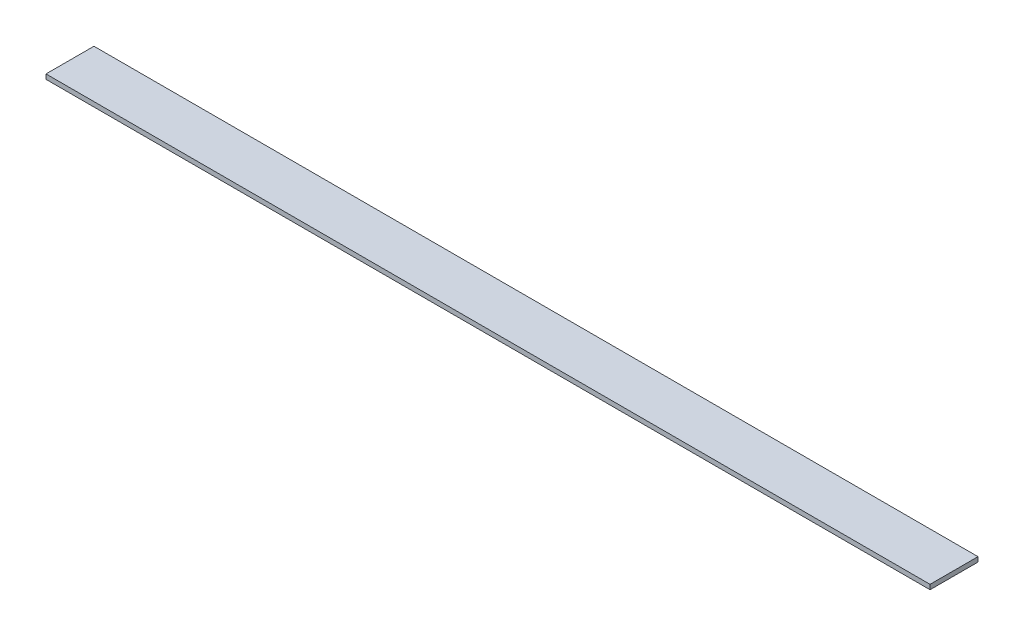
from build123d import *

# Parameters (mm, degrees)
SKETCH1_W           = 1873.25
SKETCH1_H           = 101.6
BOSS_EXTRUDE1_DEPTH = 10


with BuildPart() as part:
    # Sketch1 → Boss-Extrude1 (new body)
    with BuildSketch(Plane(origin=(0, 0, 0), x_dir=(1, 0, 0), z_dir=(0, 1, 0))):
        Rectangle(SKETCH1_W, SKETCH1_H)
    extrude(amount=BOSS_EXTRUDE1_DEPTH)


solid = part.part
